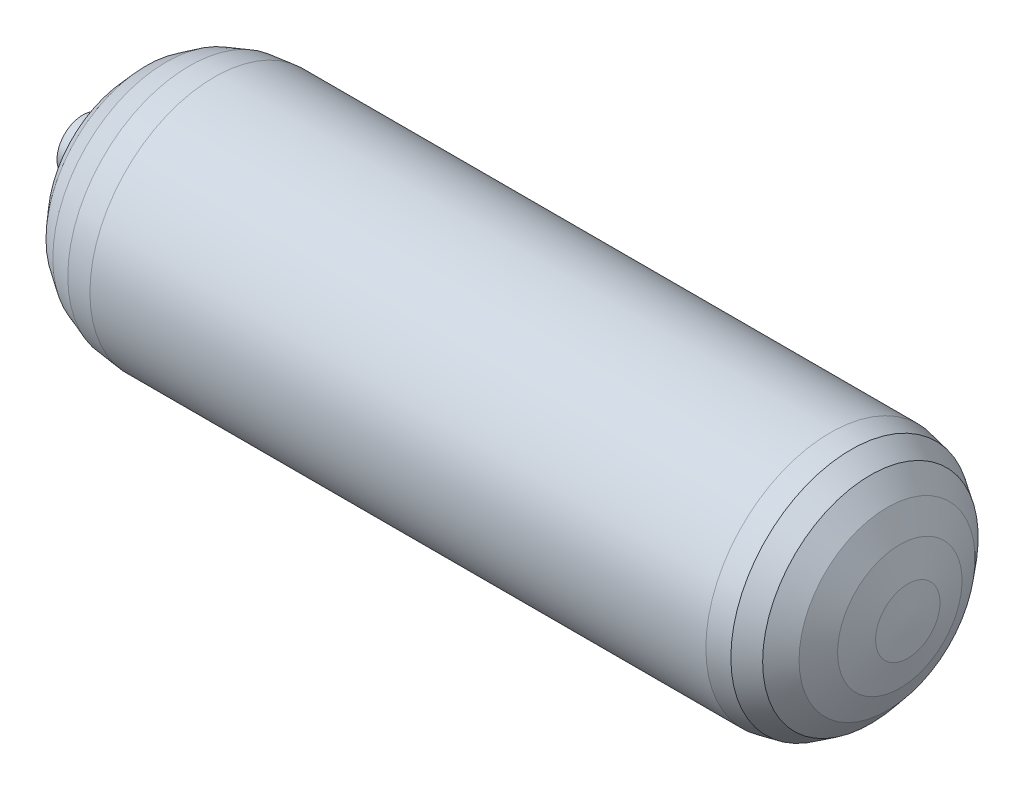
from build123d import *

# Parameters (mm, degrees)
PORT_BORE_SKETCH_W = 16
PORT_BORE_SKETCH_H = 10.1125


with BuildPart() as part:
    # Bottle Sketch → Bottle (revolve)
    with BuildSketch(Plane.XY):
        Polygon((0, 0), (0, 16), (10, 16), (22, 26), (24.044450423, 39.329180823), (30.038475773, 51.75), (39.573593129, 62.415999231), (52, 70.600308295), (66.470857294, 75.745180054), (82, 77.5), (465.6, 77.5), (478.540952255, 74.859251537), (490.6, 67.116968793), (500.955339059, 54.800775542), (508.901270189, 38.75), (513.896291314, 20.058475995), (515.6, 0), align=None)
    revolve(axis=Axis((-1000, 0, 0), (1, 0, 0)))

    # Port Bore Sketch → Port Bore (revolve, cut)
    with BuildSketch(Plane.XY):
        with Locations((7, 5.05625)):
            Rectangle(PORT_BORE_SKETCH_W, PORT_BORE_SKETCH_H)
    revolve(axis=Axis((-1000, 0, 0), (1, 0, 0)), mode=Mode.SUBTRACT)


solid = part.part
